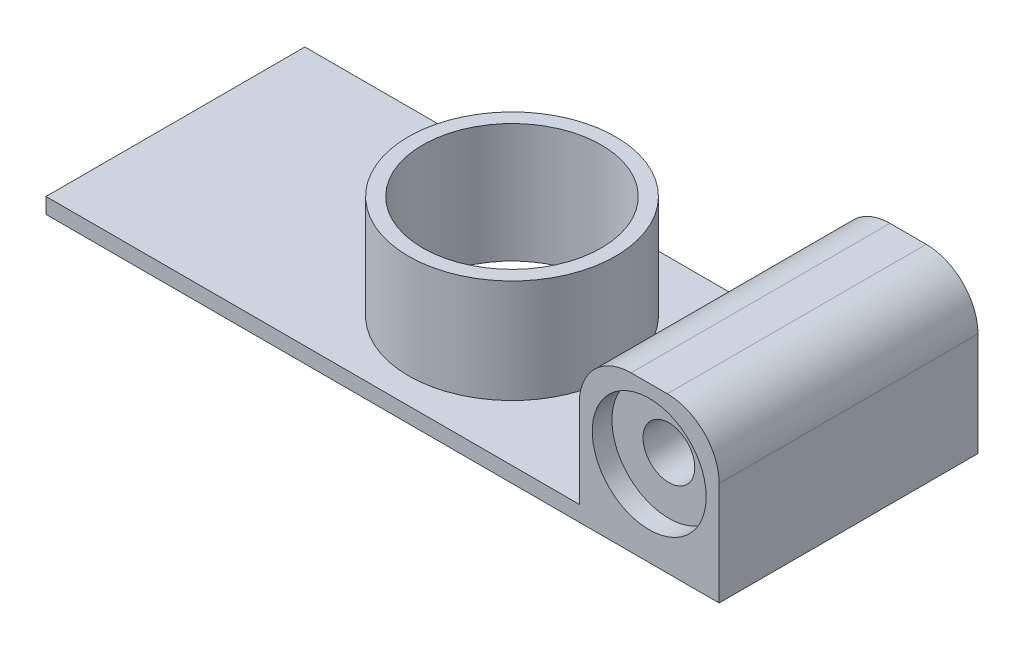
from build123d import *

# Parameters (mm, degrees)
BOSS_EXTRUDE2_DEPTH = 6
BOSS_EXTRUDE4_DEPTH = 27.000000000000004
SKETCH6_R           = 10.999999999999993
CUT_EXTRUDE3_DEPTH  = 3.8
SKETCH8_R           = 4.999999999999997
CUT_EXTRUDE4_DEPTH  = 12
CUT_EXTRUDE5_START  = -3.8
SKETCH9_R           = 11
CUT_EXTRUDE5_DEPTH  = 3.8
CUT_EXTRUDE6_START  = -12.5
SKETCH10_R          = 4.999999999999997
CUT_EXTRUDE6_DEPTH  = 12.5
FILLET1_R           = 10
FILLET2_R           = 10
CUT_EXTRUDE7_START  = -90
SKETCH10_2_R        = 4.999999999999997
CUT_EXTRUDE7_DEPTH  = 90
SKETCH14_R          = 20
BOSS_EXTRUDE5_DEPTH = 20
SKETCH15_R          = 17.25
CUT_EXTRUDE8_DEPTH  = 60.00000000000001
SKETCH16_W          = 130
SKETCH16_H          = 50
CUT_EXTRUDE9_DEPTH  = 3


with BuildPart() as part:
    # Sketch1 → Boss-Extrude2 (new body)
    with BuildSketch(Plane(origin=(0, 0, 0), x_dir=(1, 0, 0), z_dir=(0, 1, 0))):
        Polygon((-64.99999999999997, 24.999999999999993), (65.00000000000003, 24.999999999999993), (65.00000000000001, -25.000000000000007), (-64.99999999999999, -25.000000000000007), align=None)
    extrude(amount=BOSS_EXTRUDE2_DEPTH)

    # Sketch5 → Boss-Extrude4 (add)
    with BuildSketch(Plane(origin=(0, 6, 0), x_dir=(1, 0, 0), z_dir=(0, 1, 0))):
        Polygon((38.000000000000014, 24.999999999999993), (65.00000000000001, 24.999999999999993), (65.00000000000001, -25.000000000000007), (38.00000000000003, -25.000000000000007), align=None)
    extrude(amount=BOSS_EXTRUDE4_DEPTH)

    # Sketch6 → Cut-Extrude3 (cut)
    with BuildSketch(Plane.XY.offset(25.000000000000007)):
        with Locations((51.50000000000002, 19.5)):
            Circle(SKETCH6_R)
    extrude(amount=-CUT_EXTRUDE3_DEPTH, mode=Mode.SUBTRACT)

    # Sketch8 → Cut-Extrude4 (cut)
    with BuildSketch(Plane.XY.offset(21.200000000000006)):
        with Locations((51.50000000000002, 19.5)):
            Circle(SKETCH8_R)
    extrude(amount=-CUT_EXTRUDE4_DEPTH, mode=Mode.SUBTRACT)

    # Sketch9 → Cut-Extrude5 (cut)
    with BuildSketch(Plane(origin=(0, 0, -24.999999999999993), x_dir=(-1, 0, 0), z_dir=(0, 0, -1)).offset(CUT_EXTRUDE5_START)):
        with Locations((-51.50000000000003, 19.5)):
            Circle(SKETCH9_R)
    extrude(amount=CUT_EXTRUDE5_DEPTH, mode=Mode.SUBTRACT)

    # Sketch10 → Cut-Extrude6 (cut)
    with BuildSketch(Plane(origin=(0, 0, -21.199999999999992), x_dir=(-1, 0, 0), z_dir=(0, 0, -1)).offset(CUT_EXTRUDE6_START)):
        with Locations((-51.50000000000003, 19.5)):
            Circle(SKETCH10_R)
    extrude(amount=CUT_EXTRUDE6_DEPTH, mode=Mode.SUBTRACT)

    # Fillet1
    fillet1_edges = [part.edges().sort_by_distance(p)[0] for p in [
        (38.00000000000002, 33, 7.11e-15),
    ]]
    fillet(fillet1_edges, radius=FILLET1_R)

    # Fillet2
    fillet2_edges = [part.edges().sort_by_distance(p)[0] for p in [
        (65.00000000000001, 33, 7.11e-15),
    ]]
    fillet(fillet2_edges, radius=FILLET2_R)

    # Sketch10<2> → Cut-Extrude7 (cut)
    with BuildSketch(Plane(origin=(0, 0, -21.199999999999992), x_dir=(-1, 0, 0), z_dir=(0, 0, -1)).offset(CUT_EXTRUDE7_START)):
        with Locations((-51.50000000000003, 19.5)):
            Circle(SKETCH10_2_R)
    extrude(amount=CUT_EXTRUDE7_DEPTH, mode=Mode.SUBTRACT)

    # Sketch14 → Boss-Extrude5 (add)
    with BuildSketch(Plane(origin=(0, 6, 0), x_dir=(1, 0, 0), z_dir=(0, 1, 0))):
        Circle(SKETCH14_R)
    extrude(amount=BOSS_EXTRUDE5_DEPTH)

    # Sketch15 → Cut-Extrude8 (cut)
    with BuildSketch(Plane(origin=(0, 26.000000000000004, 0), x_dir=(1, 0, 0), z_dir=(0, 1, 0))):
        Circle(SKETCH15_R)
    extrude(amount=-CUT_EXTRUDE8_DEPTH, mode=Mode.SUBTRACT)

    # Sketch16 → Cut-Extrude9 (cut)
    with BuildSketch(Plane.XZ):
        Rectangle(SKETCH16_W, SKETCH16_H)
    extrude(amount=-CUT_EXTRUDE9_DEPTH, mode=Mode.SUBTRACT)


solid = part.part
